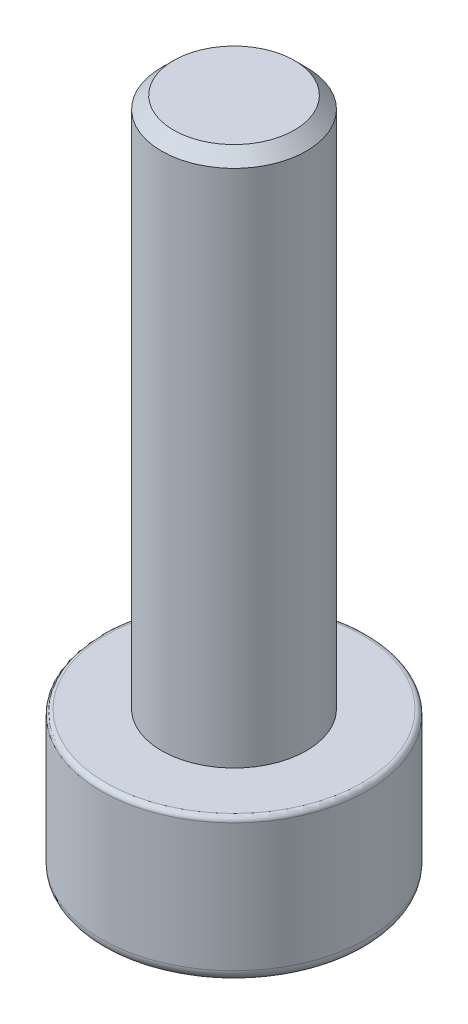
from build123d import *

# Parameters (mm, degrees)
SKETCH1_R           = 2.75
BOSS_EXTRUDE1_DEPTH = 3
SKETCH2_R           = 1.5
BOSS_EXTRUDE2_DEPTH = 11
CUT_EXTRUDE1_DEPTH  = 1.5
CHAMFER1_SIZE       = 0.25
FILLET1_R           = 0.25
CHAMFER2_SIZE       = 0.25
FILLET2_R           = 0.1


with BuildPart() as part:
    # Sketch1 → Boss-Extrude1 (new body)
    with BuildSketch(Plane(origin=(0, 0, 0), x_dir=(1, 0, 0), z_dir=(0, 1, 0))):
        with Locations(Location((0, 0, 0), (0, 0, 270))):
            Circle(SKETCH1_R)
    extrude(amount=BOSS_EXTRUDE1_DEPTH)

    # Sketch2 → Boss-Extrude2 (add)
    with BuildSketch(Plane(origin=(0, 3, 0), x_dir=(1, 0, 0), z_dir=(0, 1, 0))):
        with Locations(Location((0, 0, 0), (0, 0, 270))):
            Circle(SKETCH2_R)
    extrude(amount=BOSS_EXTRUDE2_DEPTH)

    # Sketch3 → Cut-Extrude1 (cut)
    with BuildSketch(Plane.XZ):
        Polygon((0.934168857, 0.974591477), (-0.376936549, 1.2963097), (-1.311105406, 0.321718223), (-0.934168857, -0.974591477), (0.376936549, -1.2963097), (1.311105406, -0.321718223), align=None)
    extrude(amount=-CUT_EXTRUDE1_DEPTH, mode=Mode.SUBTRACT)

    # Chamfer1
    chamfer1_edges = [part.edges().sort_by_distance(p)[0] for p in [
        (1.122637131, 0, 0.326436627),
        (0.278616154, 0, 1.135450588),
        (-0.844020977, 0, 0.809013962),
        (-1.122637131, 0, -0.326436627),
        (-0.278616154, 0, -1.135450588),
        (0.844020977, 0, -0.809013962),
    ]]
    chamfer(chamfer1_edges, length=CHAMFER1_SIZE)

    # Fillet1
    fillet1_edges = [part.edges().sort_by_distance(p)[0] for p in [
        (0, 0, -2.75),
    ]]
    fillet(fillet1_edges, radius=FILLET1_R)

    # Chamfer2
    chamfer2_edges = [part.edges().sort_by_distance(p)[0] for p in [
        (0, 14, -1.5),
    ]]
    chamfer(chamfer2_edges, length=CHAMFER2_SIZE)

    # Fillet2
    fillet2_edges = [part.edges().sort_by_distance(p)[0] for p in [
        (0, 3, -2.75),
    ]]
    fillet(fillet2_edges, radius=FILLET2_R)


solid = part.part
